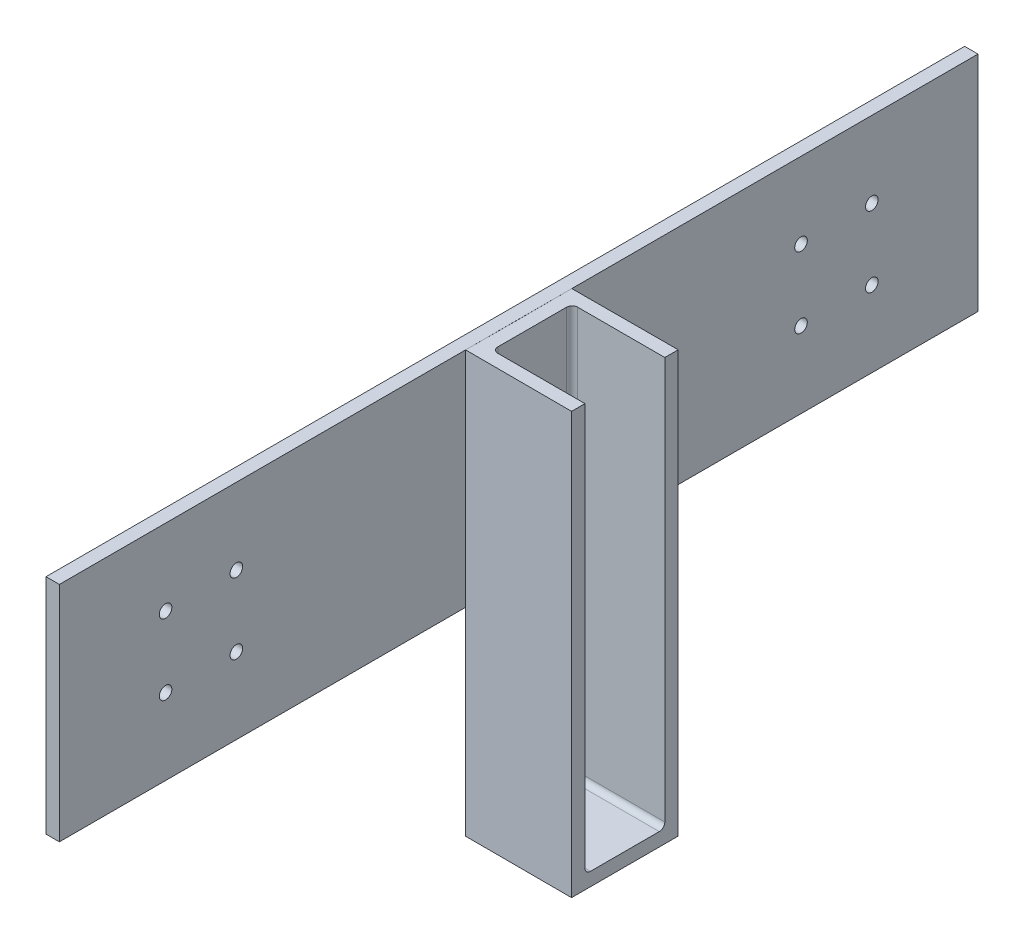
from build123d import *

# Parameters (mm, degrees)
SKETCH1_W           = 164.8
SKETCH1_H           = 40
SKETCH1_R           = 1.13
BOSS_EXTRUDE1_DEPTH = 2.4
BOSS_EXTRUDE2_DEPTH = 75.56
SKETCH3_W           = 16.629876975
SKETCH3_H           = 14.330492101
BOSS_EXTRUDE3_DEPTH = 2.4
FILLET1_R           = 1


with BuildPart() as part:
    # Sketch1 → Boss-Extrude1 (new body)
    with BuildSketch(Plane(origin=(0, 0, 0), x_dir=(0, 0, -1), z_dir=(1, 0, 0))):
        with Locations((46.422535211, 7.998591549)):
            Rectangle(SKETCH1_W, SKETCH1_H)
        with Locations((-16.927464789, 14.348591549)):
            Circle(SKETCH1_R, mode=Mode.SUBTRACT)
        with Locations(Location((-4.227464789, 14.348591549, 0), (0, 0, 180))):
            Circle(SKETCH1_R, mode=Mode.SUBTRACT)
        with Locations((-4.227464789, 1.648591549)):
            Circle(SKETCH1_R, mode=Mode.SUBTRACT)
        with Locations(Location((-16.927464789, 1.648591549, 0), (0, 0, 180))):
            Circle(SKETCH1_R, mode=Mode.SUBTRACT)
        with Locations((109.772535211, 1.648591549)):
            Circle(SKETCH1_R, mode=Mode.SUBTRACT)
        with Locations(Location((97.072535211, 1.648591549, 0), (0, 0, 180))):
            Circle(SKETCH1_R, mode=Mode.SUBTRACT)
        with Locations((97.072535211, 14.348591549)):
            Circle(SKETCH1_R, mode=Mode.SUBTRACT)
        with Locations(Location((109.772535211, 14.348591549, 0), (0, 0, 180))):
            Circle(SKETCH1_R, mode=Mode.SUBTRACT)
    extrude(amount=BOSS_EXTRUDE1_DEPTH)


with BuildPart() as body_2:
    # Sketch2 → Boss-Extrude2 (new body)
    with BuildSketch(Plane(origin=(0, 27.998591549, 0), x_dir=(1, 0, 0), z_dir=(0, 1, 0))):
        Polygon((2.4, 55.947535211), (21.45, 55.987781262), (21.45, 53.587781262), (4.820123025, 53.587781262), (4.820123025, 39.257289161), (21.45, 39.257289161), (21.45, 36.857289161), (2.4, 36.897535211), (2.420123025, 46.422535211), align=None)
    extrude(amount=-BOSS_EXTRUDE2_DEPTH)

    # Sketch3 → Boss-Extrude3 (add)
    with BuildSketch(Plane.XZ.offset(47.561408451)):
        with Locations((13.135061513, -46.422535212)):
            Rectangle(SKETCH3_W, SKETCH3_H)
    extrude(amount=-BOSS_EXTRUDE3_DEPTH)

    # Fillet1
    fillet1_edges = [body_2.edges().sort_by_distance(p)[0] for p in [
        (4.820123025, -8.581408451, -39.257289161),
        (4.820123025, -8.581408451, -53.587781262),
        (4.820123025, -45.161408451, -46.422535211),
        (13.135061513, -45.161408451, -39.257289161),
        (13.135061513, -45.161408451, -53.587781262),
    ]]
    fillet(fillet1_edges, radius=FILLET1_R)


solid = Compound([part.part, body_2.part])
